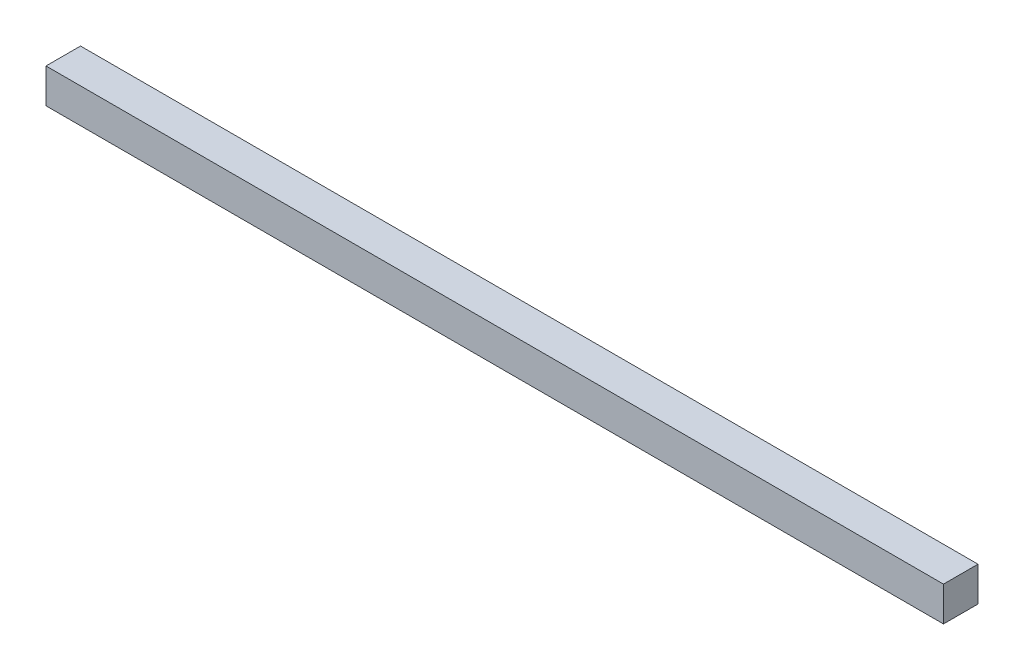
from build123d import *

# Parameters (mm, degrees)
SKETCH1_W      = 990.6
SKETCH1_H      = 38.1
EXTRUDE1_DEPTH = 38.1


with BuildPart() as part:
    # Sketch1 → Extrude1 (new body)
    with BuildSketch(Plane(origin=(0, 0, 0), x_dir=(1, 0, 0), z_dir=(0, 1, 0))):
        with Locations((495.3, 19.05)):
            Rectangle(SKETCH1_W, SKETCH1_H)
    extrude(amount=EXTRUDE1_DEPTH)


solid = part.part
